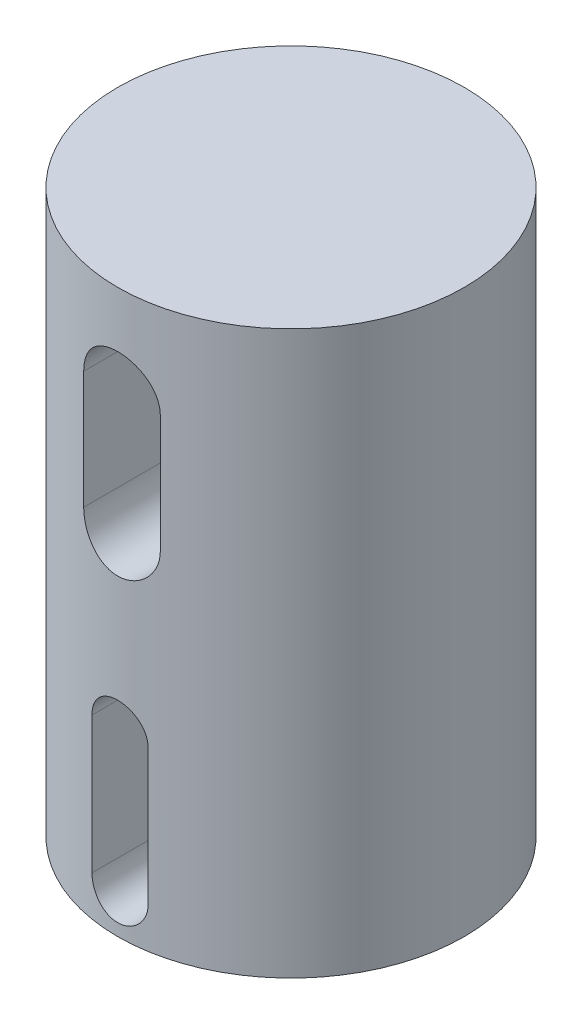
from build123d import *

# Parameters (mm, degrees)
SKETCH_1_R          = 40.061210901
EXTRUDE_1_DEPTH     = 130
CUT_EXTRUDE_1_DEPTH = 20


with BuildPart() as part:
    # 草图1 → 凸台-拉伸1 (new body)
    with BuildSketch(Plane(origin=(0, 0, 0), x_dir=(1, 0, 0), z_dir=(0, 1, 0))):
        with Locations(Location((0, 0, 0), (0, 0, 270))):
            Circle(SKETCH_1_R)
    extrude(amount=EXTRUDE_1_DEPTH)

    # 草图2 → 切除-拉伸1 (cut)
    with BuildSketch(Plane.XY.offset(40.061210901)):
        with BuildLine():
            Line((8.857338492, 108.295199344), (8.857338492, 81.062188459))
            ThreePointArc((8.857338492, 81.062188459), (0, 72.204849967), (-8.857338492, 81.062188459))
            Line((-8.857338492, 81.062188459), (-8.857338492, 108.295199344))
            ThreePointArc((-8.857338492, 108.295199344), (0, 117.152537836), (8.857338492, 108.295199344))
        make_face()
        with BuildLine():
            Line((6.477755016, 40.873667541), (6.477755016, 9.278086951))
            ThreePointArc((6.477755016, 9.278086951), (0, 2.800331935), (-6.477755016, 9.278086951))
            Line((-6.477755016, 9.278086951), (-6.477755016, 40.873667541))
            ThreePointArc((-6.477755016, 40.873667541), (0, 47.351422558), (6.477755016, 40.873667541))
        make_face()
    extrude(amount=-CUT_EXTRUDE_1_DEPTH, mode=Mode.SUBTRACT)


solid = part.part
